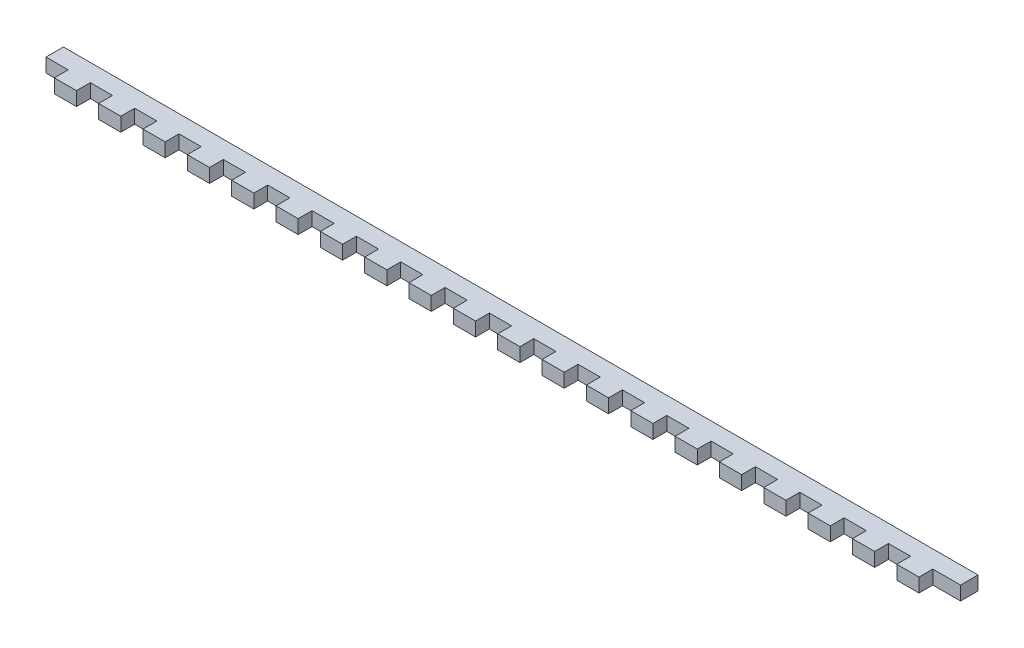
from build123d import *

# Parameters (mm, degrees)
BOSS_EXTRUDE1_DEPTH = 3.175


with BuildPart() as part:
    # Sketch1 → Boss-Extrude1 (new body)
    with BuildSketch(Plane(origin=(0, 0, 0), x_dir=(1, 0, 0), z_dir=(0, 1, 0))):
        Polygon((-139.423872549, 2.060946796), (-134.343872549, 2.060946796), (-134.343872549, -1.114053204), (-129.263872549, -1.114053204), (-129.263872549, 2.060946796), (-124.183872549, 2.060946796), (-124.183872549, -1.114053204), (-119.103872549, -1.114053204), (-119.103872549, 2.060946796), (-114.023872549, 2.060946796), (-114.023872549, -1.114053204), (-108.943872549, -1.114053204), (-108.943872549, 2.060946796), (-103.863872549, 2.060946796), (-103.863872549, -1.114053204), (-98.783872549, -1.114053204), (-98.783872549, 2.060946796), (-93.703872549, 2.060946796), (-93.703872549, -1.114053204), (-88.623872549, -1.114053204), (-88.623872549, 2.060946796), (-83.543872549, 2.060946796), (-83.543872549, -1.114053204), (-78.463872549, -1.114053204), (-78.463872549, 2.060946796), (-73.383872549, 2.060946796), (-73.383872549, -1.114053204), (-68.303872549, -1.114053204), (-68.303872549, 2.060946796), (-63.223872549, 2.060946796), (-63.223872549, -1.114053204), (-58.143872549, -1.114053204), (-58.143872549, 2.060946796), (-53.063872549, 2.060946796), (-53.063872549, -1.114053204), (-47.983872549, -1.114053204), (-47.983872549, 2.060946796), (-42.903872549, 2.060946796), (-42.903872549, -1.114053204), (-37.823872549, -1.114053204), (-37.823872549, 2.060946796), (-32.743872549, 2.060946796), (-32.743872549, -1.114053204), (-27.663872549, -1.114053204), (-27.663872549, 2.060946796), (-22.583872549, 2.060946796), (-22.583872549, -1.114053204), (-17.503872549, -1.114053204), (-17.503872549, 2.060946796), (-12.423872549, 2.060946796), (-12.423872549, -1.114053204), (-7.343872549, -1.114053204), (-7.343872549, 2.060946796), (-2.263872549, 2.060946796), (-2.263872549, -1.114053204), (2.816127451, -1.114053204), (2.816127451, 2.060946796), (7.896127451, 2.060946796), (7.896127451, -1.114053204), (12.976127451, -1.114053204), (12.976127451, 2.060946796), (18.056127451, 2.060946796), (18.056127451, -1.114053204), (23.136127451, -1.114053204), (23.136127451, 2.060946796), (28.216127451, 2.060946796), (28.216127451, -1.114053204), (33.296127451, -1.114053204), (33.296127451, 2.060946796), (38.376127451, 2.060946796), (38.376127451, -1.114053204), (43.456127451, -1.114053204), (43.456127451, 2.060946796), (48.536127451, 2.060946796), (48.536127451, -1.114053204), (53.616127451, -1.114053204), (53.616127451, 2.060946796), (58.696127451, 2.060946796), (58.696127451, -1.114053204), (63.776127451, -1.114053204), (63.776127451, 2.060946796), (70.126127451, 2.060946796), (70.126127451, 6.060946796), (-139.423872549, 6.060946796), align=None)
    extrude(amount=BOSS_EXTRUDE1_DEPTH)


solid = part.part
